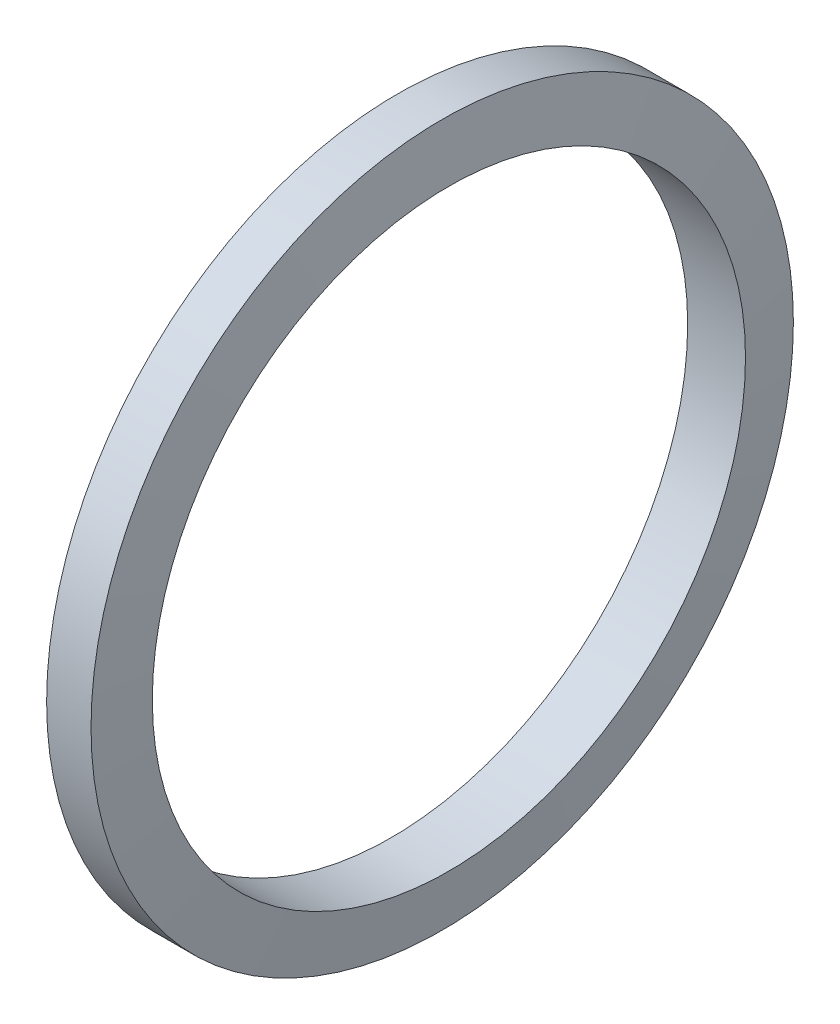
from build123d import *


with BuildPart() as part:
    # Sketch 180 → 旋转1 (revolve)
    with BuildSketch(Plane.XY, mode=Mode.PRIVATE) as revolve_1_sk:
        Polygon((-7.811072273, 80.15), (-6, 94.9), (6, 94.9), (7.811072273, 80.15), align=None)
    revolve(revolve_1_sk.sketch.rotate(Axis((-2.616323804, 0, 0), (1, 0, 0)), 90), axis=Axis((-2.616323804, 0, 0), (1, 0, 0)))


solid = part.part
